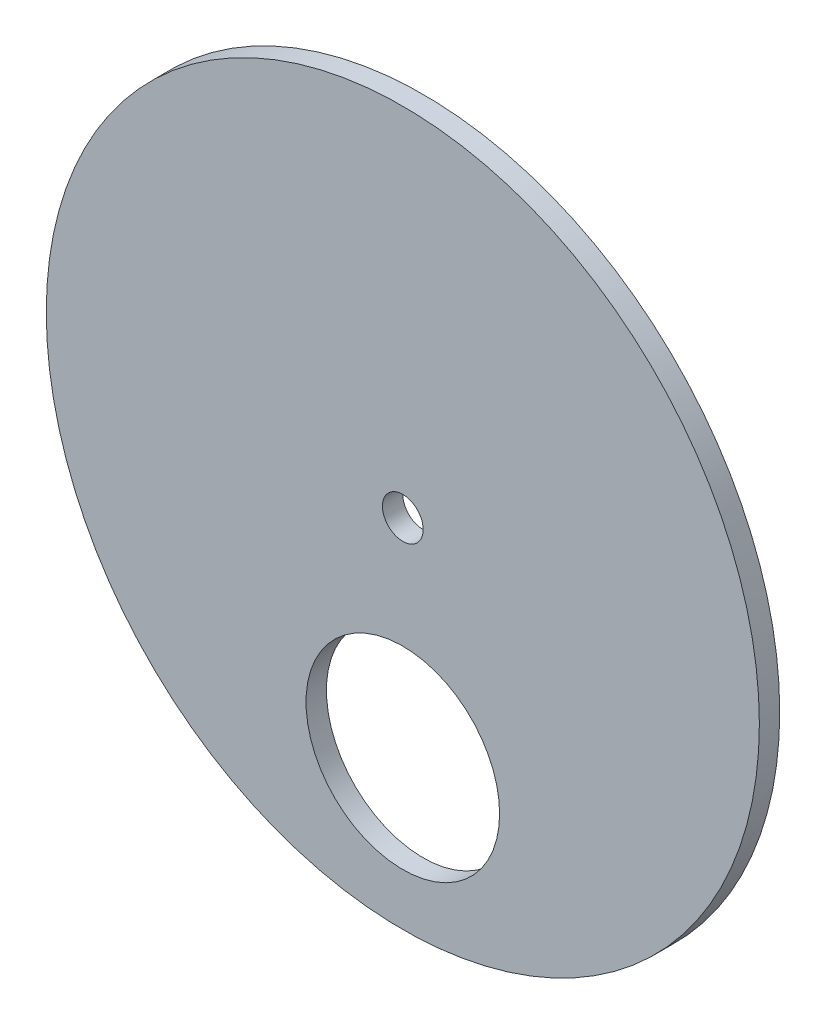
from build123d import *

# Parameters (mm, degrees)
BOSS_EXTRUDE3_DEPTH = 10


with BuildPart() as part:
    # Sketch1 → Boss-Extrude3 (new body)
    with BuildSketch(Plane.XY):
        with BuildLine():
            ThreePointArc((175, 0), (-123.743686708, 123.743686708), (0, -175))
            ThreePointArc((0, -175), (123.743686708, -123.743686708), (175, 0))
        make_face()
        with BuildLine():
            ThreePointArc((0, -149.505245109), (-47.5, -102.005245109), (0, -54.505245109))
            ThreePointArc((0, -54.505245109), (33.587572106, -68.417673002), (47.5, -102.005245109))
            ThreePointArc((47.5, -102.005245109), (33.587572106, -135.592817215), (0, -149.505245109))
        make_face(mode=Mode.SUBTRACT)
        with BuildLine():
            ThreePointArc((10, 0), (7.071067812, -7.071067812), (0, -10))
            ThreePointArc((0, -10), (-7.071067812, 7.071067812), (10, 0))
        make_face(mode=Mode.SUBTRACT)
    extrude(amount=BOSS_EXTRUDE3_DEPTH)


solid = part.part
